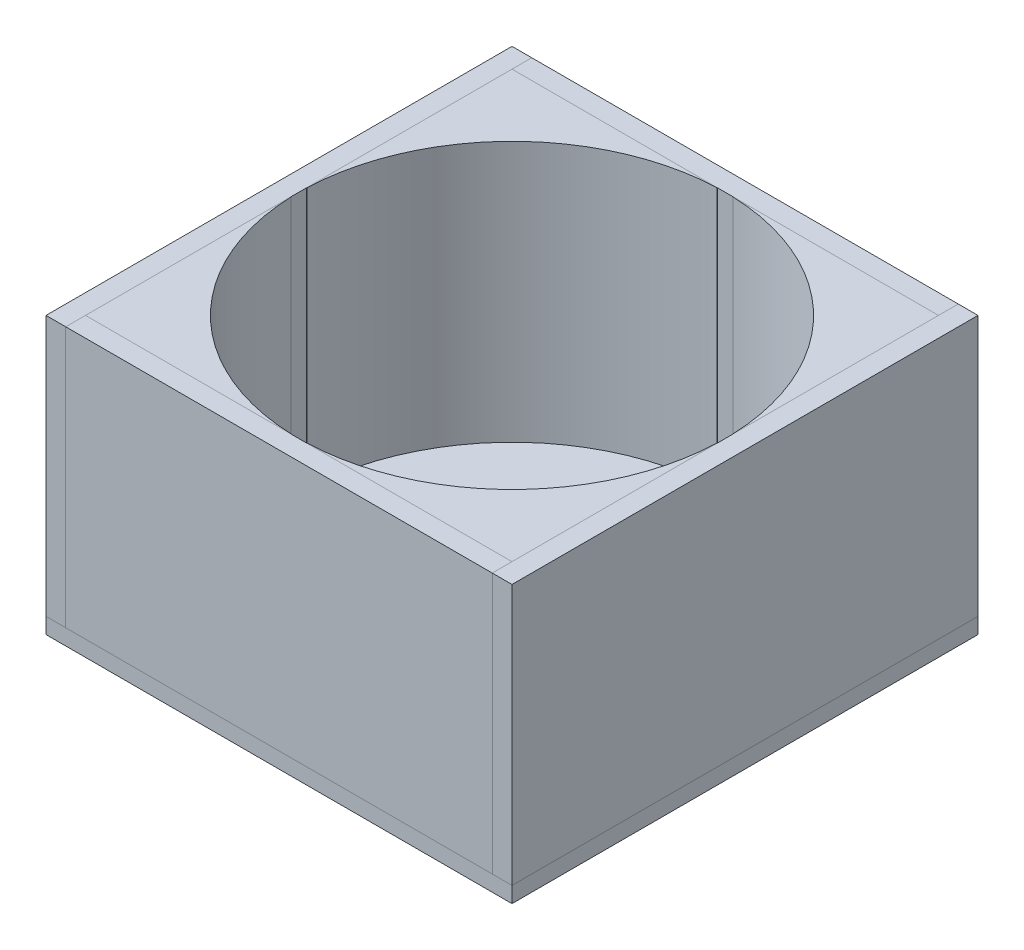
from build123d import *

# Parameters (mm, degrees)
SKETCH1_W             = 1371.6
SKETCH1_H             = 63.5
BOSS_EXTRUDE1_DEPTH   = 838.2
BOSS_EXTRUDE1_2_DEPTH = 838.2
SKETCH2_W             = 63.5
SKETCH2_H             = 1498.6
BOSS_EXTRUDE2_DEPTH   = 838.2
BOSS_EXTRUDE2_2_DEPTH = 838.2
SKETCH3_W             = 1498.6
SKETCH3_H             = 1498.6
BOSS_EXTRUDE3_DEPTH   = 50.8
BOSS_EXTRUDE4_DEPTH   = 838.2
BOSS_EXTRUDE4_2_DEPTH = 838.2
BOSS_EXTRUDE4_3_DEPTH = 838.2
BOSS_EXTRUDE4_4_DEPTH = 838.2


with BuildPart() as part:
    # Sketch1 → Boss-Extrude1 (new body)
    with BuildSketch(Plane(origin=(0, 0, 0), x_dir=(1, 0, 0), z_dir=(0, 1, 0))):
        with Locations((0, 717.55)):
            Rectangle(SKETCH1_W, SKETCH1_H)
    extrude(amount=BOSS_EXTRUDE1_DEPTH)


with BuildPart() as body_2:
    # Sketch1 → Boss-Extrude1 2 (new body)
    with BuildSketch(Plane(origin=(0, 0, 0), x_dir=(1, 0, 0), z_dir=(0, 1, 0))):
        with Locations((0, -717.55)):
            Rectangle(SKETCH1_W, SKETCH1_H)
    extrude(amount=BOSS_EXTRUDE1_2_DEPTH)


with BuildPart() as body_3:
    # Sketch2 → Boss-Extrude2 (new body)
    with BuildSketch(Plane(origin=(0, 0, 0), x_dir=(1, 0, 0), z_dir=(0, 1, 0))):
        with Locations((717.55, 0)):
            Rectangle(SKETCH2_W, SKETCH2_H)
    extrude(amount=BOSS_EXTRUDE2_DEPTH)


with BuildPart() as body_4:
    # Sketch2 → Boss-Extrude2 2 (new body)
    with BuildSketch(Plane(origin=(0, 0, 0), x_dir=(1, 0, 0), z_dir=(0, 1, 0))):
        with Locations((-717.55, 0)):
            Rectangle(SKETCH2_W, SKETCH2_H)
    extrude(amount=BOSS_EXTRUDE2_2_DEPTH)


with BuildPart() as body_5:
    # Sketch3 → Boss-Extrude3 (new body)
    with BuildSketch(Plane.XZ):
        Rectangle(SKETCH3_W, SKETCH3_H)
    extrude(amount=BOSS_EXTRUDE3_DEPTH)


with BuildPart() as body_6:
    # Sketch4 → Boss-Extrude4 (new body)
    with BuildSketch(Plane(origin=(0, 0, 0), x_dir=(1, 0, 0), z_dir=(0, 1, 0))):
        with BuildLine():
            Line((685.8, -685.8), (685.8, -25.4))
            Line((685.8, -25.4), (685.329468212, -25.4))
            ThreePointArc((685.329468212, -25.4), (484.933830538, -484.933830538), (25.4, -685.329468212))
            Line((25.4, -685.329468212), (25.4, -685.8))
            Line((25.4, -685.8), (685.8, -685.8))
        make_face()
    extrude(amount=BOSS_EXTRUDE4_DEPTH)


with BuildPart() as body_7:
    # Sketch4 → Boss-Extrude4 2 (new body)
    with BuildSketch(Plane(origin=(0, 0, 0), x_dir=(1, 0, 0), z_dir=(0, 1, 0))):
        with BuildLine():
            Line((-685.8, 685.8), (-685.8, 25.4))
            Line((-685.8, 25.4), (-685.329468212, 25.4))
            ThreePointArc((-685.329468212, 25.4), (-484.933830538, 484.933830538), (-25.4, 685.329468212))
            Line((-25.4, 685.329468212), (-25.4, 685.8))
            Line((-25.4, 685.8), (-685.8, 685.8))
        make_face()
    extrude(amount=BOSS_EXTRUDE4_2_DEPTH)


with BuildPart() as body_8:
    # Sketch4 → Boss-Extrude4 3 (new body)
    with BuildSketch(Plane(origin=(0, 0, 0), x_dir=(1, 0, 0), z_dir=(0, 1, 0))):
        with BuildLine():
            Line((25.4, 685.8), (685.8, 685.8))
            Line((685.8, 685.8), (685.8, 25.4))
            Line((685.8, 25.4), (685.329468212, 25.4))
            ThreePointArc((685.329468212, 25.4), (484.933830538, 484.933830538), (25.4, 685.329468212))
            Line((25.4, 685.329468212), (25.4, 685.8))
        make_face()
    extrude(amount=BOSS_EXTRUDE4_3_DEPTH)


with BuildPart() as body_9:
    # Sketch4 → Boss-Extrude4 4 (new body)
    with BuildSketch(Plane(origin=(0, 0, 0), x_dir=(1, 0, 0), z_dir=(0, 1, 0))):
        with BuildLine():
            Line((-25.4, -685.8), (-685.8, -685.8))
            Line((-685.8, -685.8), (-685.8, -25.4))
            Line((-685.8, -25.4), (-685.329468212, -25.4))
            ThreePointArc((-685.329468212, -25.4), (-484.933830538, -484.933830538), (-25.4, -685.329468212))
            Line((-25.4, -685.329468212), (-25.4, -685.8))
        make_face()
    extrude(amount=BOSS_EXTRUDE4_4_DEPTH)


solid = Compound([part.part, body_2.part, body_3.part, body_4.part, body_5.part, body_6.part, body_7.part, body_8.part, body_9.part])
